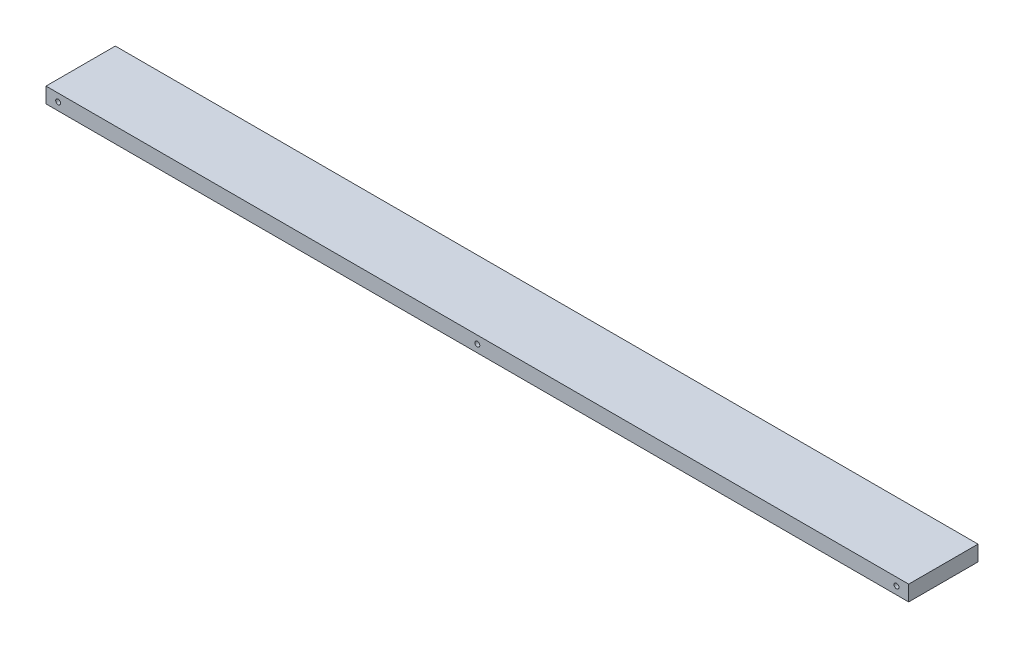
from build123d import *

# Parameters (mm, degrees)
SKETCH1_W           = 709
SKETCH1_H           = 56.98
BOSS_EXTRUDE1_DEPTH = 12.7
SKETCH2_R           = 2.0195
CUT_EXTRUDE1_DEPTH  = 12.7


with BuildPart() as part:
    # Sketch1 → Boss-Extrude1 (new body)
    with BuildSketch(Plane(origin=(0, 0, 0), x_dir=(1, 0, 0), z_dir=(0, 1, 0))):
        with Locations((354.5, 28.49)):
            Rectangle(SKETCH1_W, SKETCH1_H)
    extrude(amount=BOSS_EXTRUDE1_DEPTH)

    # Sketch2 → Cut-Extrude1 (cut)
    with BuildSketch(Plane.XY):
        with Locations((699, 6.35)):
            Circle(SKETCH2_R)
        with Locations((354.5, 6.35)):
            Circle(SKETCH2_R)
        with Locations((10, 6.35)):
            Circle(SKETCH2_R)
    extrude(amount=-CUT_EXTRUDE1_DEPTH, mode=Mode.SUBTRACT)


solid = part.part
